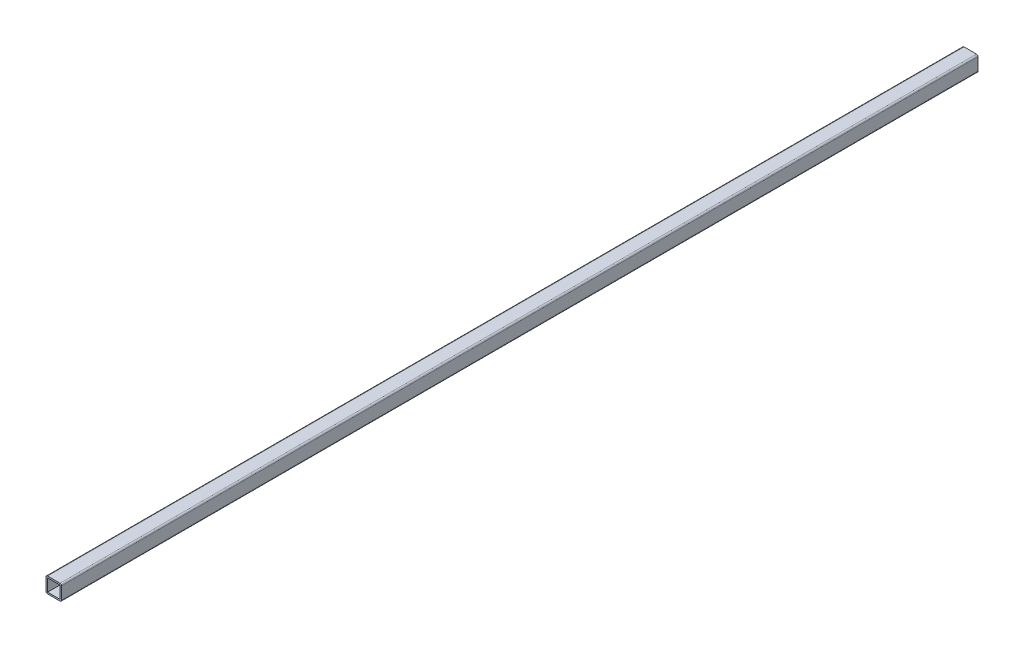
from build123d import *

# Parameters (mm, degrees)
SKETCH1_W           = 20.32
SKETCH1_H           = 20.32
BOSS_EXTRUDE1_DEPTH = 1500


with BuildPart() as part:
    # Sketch1 → Boss-Extrude1 (new body)
    with BuildSketch(Plane.XY):
        with BuildLine():
            Line((-10.16, 12.7), (10.16, 12.7))
            ThreePointArc((10.16, 12.7), (11.956051224, 11.956051224), (12.7, 10.16))
            Line((12.7, 10.16), (12.7, -10.16))
            ThreePointArc((12.7, -10.16), (11.956051224, -11.956051224), (10.16, -12.7))
            Line((10.16, -12.7), (-10.16, -12.7))
            ThreePointArc((-10.16, -12.7), (-11.956051224, -11.956051224), (-12.7, -10.16))
            Line((-12.7, -10.16), (-12.7, 10.16))
            ThreePointArc((-12.7, 10.16), (-11.956051224, 11.956051224), (-10.16, 12.7))
        make_face()
        Rectangle(SKETCH1_W, SKETCH1_H, mode=Mode.SUBTRACT)
    extrude(amount=BOSS_EXTRUDE1_DEPTH)


solid = part.part
